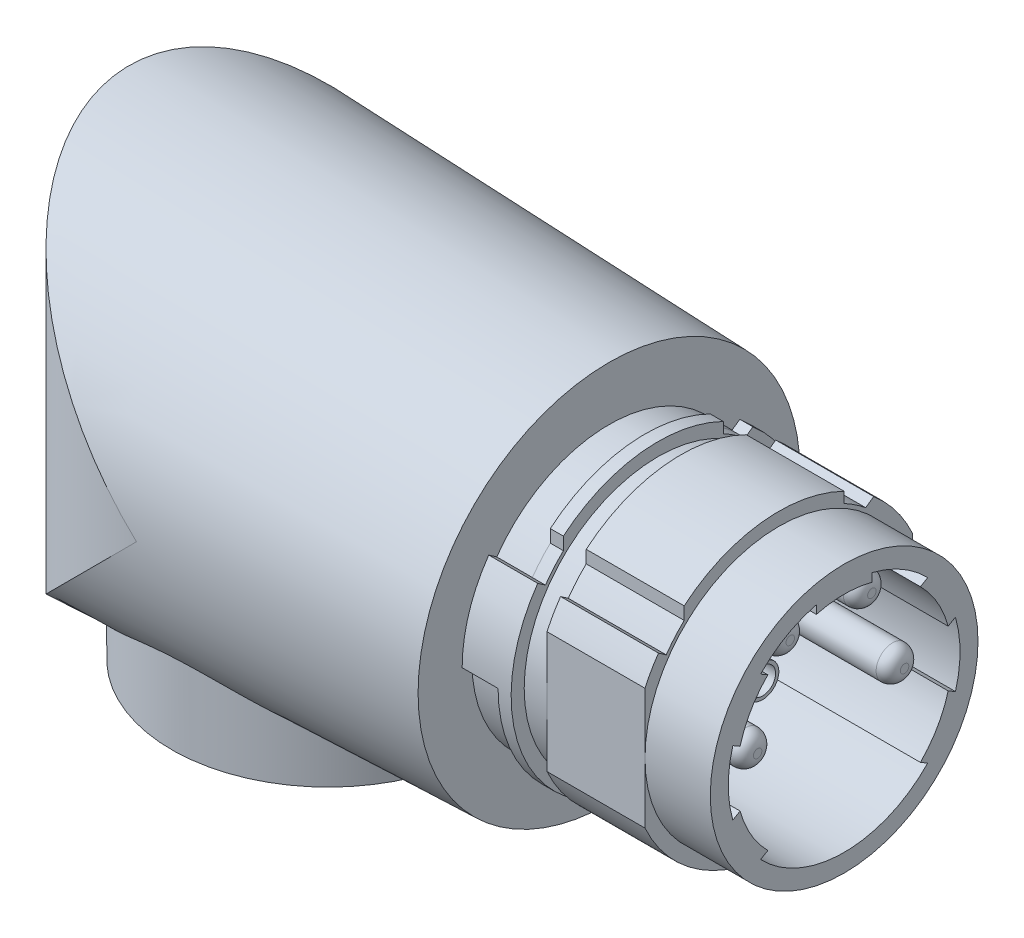
from build123d import *

# Parameters (mm, degrees)
EXTRUDE3_DEPTH    = 45.72
SKETCH15_R        = 12.192
EXTRUDE12_DEPTH   = 6.35
EXTRUDE4_REACH    = 68.174
SKETCH7_R         = 9.017
EXTRUDE5_DEPTH    = 13.97
EXTRUDE6_START    = 2.794
EXTRUDE6_DEPTH    = 2.794
SKETCH9_W         = 5.08
SKETCH9_H         = 12.7
EXTRUDE7_DEPTH    = 12.7
EXTRUDE8_DEPTH    = 13.97
CIRPATTERN1_COUNT = 6
SKETCH11_R        = 1.27
EXTRUDE9_DEPTH    = 12.954
SKETCH12_R        = 1.27
SKETCH12_R_2      = 1.016
EXTRUDE10_DEPTH   = 3.81
FILLET1_R         = 0.9398


with BuildPart() as part:
    # Sketch3 → Revolve1 (revolve)
    with BuildSketch(Plane.XY, mode=Mode.PRIVATE) as revolve1_sk:
        Polygon((-15.494, 16.0655), (-15.494, 32.258), (21.844, 30.9245), (21.844, 28.7655), (40.132, 28.7655), (40.132, 16.0655), align=None)
    revolve(revolve1_sk.sketch.rotate(Axis((-15.494, 16.0655, 0), (1, 0, 0)), 180), axis=Axis((-15.494, 16.0655, 0), (1, 0, 0)))

    # Sketch4 → Extrude3 (cut, symmetric)
    with BuildSketch(Plane(origin=(0, 0, 0), x_dir=(1, 0, 0), z_dir=(0, 1, 0))):
        with BuildLine():
            Line((0.688183019, 15.614564892), (0.688183019, 19.05))
            Line((0.688183019, 19.05), (-24.711816981, 19.05))
            Line((-24.711816981, 19.05), (-24.711816981, -19.05))
            Line((-24.711816981, -19.05), (0.688183019, -19.05))
            Line((0.688183019, -19.05), (0.688183019, -15.614564892))
            ThreePointArc((0.688183019, -15.614564892), (-15.494, 0), (0.688183019, 15.614564892))
        make_face()
    extrude(amount=EXTRUDE3_DEPTH, both=True, mode=Mode.SUBTRACT)

    # Sketch5 → Cut-Revolve1 (revolve, cut)
    with BuildSketch(Plane.XY, mode=Mode.PRIVATE) as cut_revolve1_sk:
        Polygon((21.844, 26.7335), (24.638, 26.7335), (24.638, 27.4955), (25.654, 27.4955), (25.654, 26.4795), (27.432, 26.4795), (27.432, 27.4955), (35.052, 27.4955), (35.052, 26.4795), (40.132, 26.4795), (40.132, 28.7655), (21.844, 28.7655), align=None)
    revolve(cut_revolve1_sk.sketch.rotate(Axis((0.688183019, 16.0655, 0), (1, 0, 0)), 90), axis=Axis((0.688183019, 16.0655, 0), (1, 0, 0)), mode=Mode.SUBTRACT)

    # Sketch15 → Extrude12 (add)
    with BuildSketch(Plane(origin=(0, 0, 0), x_dir=(1, 0, 0), z_dir=(0, 1, 0))):
        Circle(SKETCH15_R)
    extrude(amount=EXTRUDE12_DEPTH)

    # Sketch6 → Extrude4 (cut, up to next)
    with BuildSketch(Plane(origin=(40.132, 0, 0), x_dir=(0, 0, -1), z_dir=(1, 0, 0)), mode=Mode.PRIVATE) as extrude4_sk1:
        with BuildLine():
            Line((-7.366, 24.805462471), (-7.366, 23.822583588))
            ThreePointArc((-7.366, 23.822583588), (-8.104968608, 23.046888519), (-8.76264144, 22.201167591))
            Line((-8.76264144, 22.201167591), (-9.362907866, 22.621478667))
            ThreePointArc((-9.362907866, 22.621478667), (-8.435433357, 23.778370029), (-7.366, 24.805462471))
        make_face()
    extrude4_tool1 = extrude(extrude4_sk1.sketch, amount=-EXTRUDE4_REACH, mode=Mode.PRIVATE) & part.part
    # Sketch6 → Extrude4 (cut, up to next)
    with BuildSketch(Plane(origin=(40.132, 0, 0), x_dir=(0, 0, -1), z_dir=(1, 0, 0)), mode=Mode.PRIVATE) as extrude4_sk2:
        with BuildLine():
            Line((6.7564, 24.358952889), (7.378733083, 24.794715205))
            ThreePointArc((7.378733083, 24.794715205), (6.274943894, 25.619032285), (5.08, 26.30456734))
            Line((5.08, 26.30456734), (5.08, 25.479526863))
            ThreePointArc((5.08, 25.479526863), (5.944662543, 24.958828344), (6.7564, 24.358952889))
        make_face()
    extrude4_tool2 = extrude(extrude4_sk2.sketch, amount=-EXTRUDE4_REACH, mode=Mode.PRIVATE) & part.part
    # Sketch6 → Extrude4 (cut, up to next)
    with BuildSketch(Plane(origin=(40.132, 0, 0), x_dir=(0, 0, -1), z_dir=(1, 0, 0)), mode=Mode.PRIVATE) as extrude4_sk3:
        with BuildLine():
            Line((0.254, 5.371305978), (0.254, 4.638322571))
            ThreePointArc((0.254, 4.638322571), (2.459443831, 4.903240549), (4.572, 5.589731961))
            Line((4.572, 5.589731961), (3.859344319, 6.088738842))
            ThreePointArc((3.859344319, 6.088738842), (2.087720731, 5.573992771), (0.254, 5.371305978))
        make_face()
    extrude4_tool3 = extrude(extrude4_sk3.sketch, amount=-EXTRUDE4_REACH, mode=Mode.PRIVATE) & part.part
    add(extrude4_tool1.solids().sort_by_distance((40.132, 23.417127, 8.259947))[0], mode=Mode.SUBTRACT)
    add(extrude4_tool1.solids().sort_by_distance((40.132, 23.417127, 8.259947))[1], mode=Mode.SUBTRACT)
    add(extrude4_tool2.solids().sort_by_distance((40.132, 25.287842, -6.106057))[0], mode=Mode.SUBTRACT)
    add(extrude4_tool2.solids().sort_by_distance((40.132, 25.287842, -6.106057))[1], mode=Mode.SUBTRACT)
    add(extrude4_tool3.solids().sort_by_distance((40.132, 5.289374, -2.266983))[0], mode=Mode.SUBTRACT)
    add(extrude4_tool3.solids().sort_by_distance((40.132, 5.289374, -2.266983))[1], mode=Mode.SUBTRACT)

    # Sketch7 → Extrude5 (cut)
    with BuildSketch(Plane(origin=(40.132, 0, 0), x_dir=(0, 0, -1), z_dir=(1, 0, 0))):
        with Locations((0, 16.0655)):
            Circle(SKETCH7_R)
    extrude(amount=-EXTRUDE5_DEPTH, mode=Mode.SUBTRACT)

    # Sketch8 → Extrude6 (add)
    with BuildSketch(Plane(origin=(21.844, 0, 0), x_dir=(0, 0, -1), z_dir=(1, 0, 0)).offset(EXTRUDE6_START)):
        with BuildLine():
            Line((-9.362907866, 22.621478667), (-8.76264144, 22.201167591))
            Line((-8.76264144, 22.201167591), (-8.738714008, 22.184413423))
            ThreePointArc((-8.738714008, 22.184413423), (-10.174252431, 19.273429469), (-10.668, 16.0655))
            Line((-10.668, 16.0655), (-11.43, 16.0655))
            ThreePointArc((-11.43, 16.0655), (-10.900984747, 19.502567288), (-9.362907866, 22.621478667))
        make_face()
        with BuildLine():
            Line((4.572, 5.589731961), (3.830515001, 6.108925347))
            ThreePointArc((3.830515001, 6.108925347), (6.571018978, 7.661457306), (8.738714008, 9.946586577))
            Line((8.738714008, 9.946586577), (9.362907866, 9.509521333))
            ThreePointArc((9.362907866, 9.509521333), (7.237858902, 7.219127946), (4.572, 5.589731961))
        make_face()
    extrude(amount=-EXTRUDE6_DEPTH)

    # Sketch9 → Extrude7 (cut)
    with BuildSketch(Plane(origin=(40.132, 0, 0), x_dir=(0, 0, -1), z_dir=(1, 0, 0))):
        with Locations((-12.954, 16.0655)):
            Rectangle(SKETCH9_W, SKETCH9_H)
        with Locations((12.954, 16.0655)):
            Rectangle(SKETCH9_W, SKETCH9_H)
    extrude(amount=-EXTRUDE7_DEPTH, mode=Mode.SUBTRACT)

    # Sketch10 → Extrude8 (add)
    with BuildSketch(Plane(origin=(40.132, 0, 0), x_dir=(0, 0, -1), z_dir=(1, 0, 0))):
        with BuildLine():
            Line((-2.159, 24.820213473), (-2.159, 24.164675452))
            ThreePointArc((-2.159, 24.164675452), (0, 24.4475), (2.159, 24.164675452))
            Line((2.159, 24.164675452), (2.159, 24.820213473))
            ThreePointArc((2.159, 24.820213473), (0, 25.0825), (-2.159, 24.820213473))
        make_face()
    extrude8 = extrude(amount=-EXTRUDE8_DEPTH)

    # CirPattern1: Extrude8 ×6 about axis, 1 skipped
    cirpattern1_axis = Axis((0, 16.0655, 0), (-1, 0, 0))
    add([extrude8.rotate(cirpattern1_axis, i * 360 / CIRPATTERN1_COUNT) for i in range(1, CIRPATTERN1_COUNT) if i not in (3,)])

    # Sketch11 → Extrude9 (add)
    with BuildSketch(Plane(origin=(26.162, 0, 0), x_dir=(0, 0, -1), z_dir=(1, 0, 0))):
        with Locations((-3.175, 22.4155)):
            Circle(SKETCH11_R)
        with Locations((3.175, 22.4155)):
            Circle(SKETCH11_R)
        with Locations((-5.715, 16.0655)):
            Circle(SKETCH11_R)
        with Locations((5.715, 16.0655)):
            Circle(SKETCH11_R)
    extrude(amount=EXTRUDE9_DEPTH)

    # Sketch12 → Extrude10 (add)
    # profile 1 of 5: a face of its own
    with BuildSketch(Plane(origin=(26.162, 0, 0), x_dir=(0, 0, -1), z_dir=(1, 0, 0))):
        with Locations(Location((0, 16.0655, 0), (0, 0, 180))):
            Circle(SKETCH12_R)
        with Locations(Location((0, 16.0655, 0), (0, 0, 180))):
            Circle(SKETCH12_R_2, mode=Mode.SUBTRACT)
    # profile 2 of 5: a face of its own
    with BuildSketch(Plane(origin=(26.162, 0, 0), x_dir=(0, 0, -1), z_dir=(1, 0, 0))):
        with Locations(Location((0, 12.8905, 0), (0, 0, 180))):
            Circle(SKETCH12_R)
        with Locations(Location((0, 12.8905, 0), (0, 0, 180))):
            Circle(SKETCH12_R_2, mode=Mode.SUBTRACT)
    # profile 3 of 5: a face of its own
    with BuildSketch(Plane(origin=(26.162, 0, 0), x_dir=(0, 0, -1), z_dir=(1, 0, 0))):
        with Locations(Location((0, 9.4615, 0), (0, 0, 180))):
            Circle(SKETCH12_R)
        with Locations(Location((0, 9.4615, 0), (0, 0, 180))):
            Circle(SKETCH12_R_2, mode=Mode.SUBTRACT)
    # profile 4 of 5: a face of its own
    with BuildSketch(Plane(origin=(26.162, 0, 0), x_dir=(0, 0, -1), z_dir=(1, 0, 0))):
        with Locations(Location((3.81, 11.6205, 0), (0, 0, 180))):
            Circle(SKETCH12_R)
        with Locations(Location((3.81, 11.6205, 0), (0, 0, 180))):
            Circle(SKETCH12_R_2, mode=Mode.SUBTRACT)
    # profile 5 of 5: a face of its own
    with BuildSketch(Plane(origin=(26.162, 0, 0), x_dir=(0, 0, -1), z_dir=(1, 0, 0))):
        with Locations(Location((-3.81, 11.6205, 0), (0, 0, 180))):
            Circle(SKETCH12_R)
        with Locations(Location((-3.81, 11.6205, 0), (0, 0, 180))):
            Circle(SKETCH12_R_2, mode=Mode.SUBTRACT)
    extrude(amount=EXTRUDE10_DEPTH)

    # Fillet1
    fillet1_edges = [part.edges().sort_by_distance(p)[0] for p in [
        (39.116, 22.4155, 4.445),
        (39.116, 22.4155, -1.905),
        (39.116, 16.0655, 6.985),
        (39.116, 16.0655, -4.445),
    ]]
    fillet(fillet1_edges, radius=FILLET1_R)


solid = part.part
